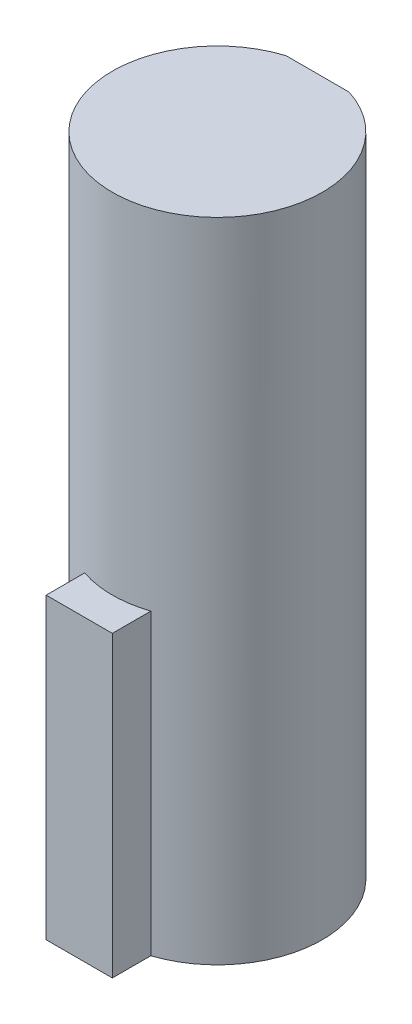
from build123d import *

# Parameters (mm, degrees)
BOSS_EXTRUDE1_DEPTH = 20.75
SKETCH2_R           = 7.3
BOSS_EXTRUDE2_DEPTH = 24.25
CUT_EXTRUDE1_DEPTH  = 50


with BuildPart() as part:
    # Sketch1 → Boss-Extrude1 (new body)
    with BuildSketch(Plane(origin=(0, 0, 0), x_dir=(1, 0, 0), z_dir=(0, 1, 0))):
        with BuildLine():
            Line((-2.3, -6.92820323), (-2.3, -9.601067812))
            Line((-2.3, -9.601067812), (2.3, -9.601067812))
            Line((2.3, -9.601067812), (2.3, -6.92820323))
            ThreePointArc((2.3, -6.92820323), (0, 7.3), (-2.3, -6.92820323))
        make_face()
    extrude(amount=BOSS_EXTRUDE1_DEPTH)

    # Sketch2 → Boss-Extrude2 (add)
    with BuildSketch(Plane(origin=(0, 20.75, 0), x_dir=(1, 0, 0), z_dir=(0, 1, 0))):
        with Locations(Location((0, 0, 0), (0, 0, 251.635051289))):
            Circle(SKETCH2_R)
    extrude(amount=BOSS_EXTRUDE2_DEPTH)

    # Sketch3 → Cut-Extrude1 (cut)
    with BuildSketch(Plane(origin=(0, 45, 0), x_dir=(1, 0, 0), z_dir=(0, 1, 0))):
        with BuildLine():
            Line((-2.5, 6.96491206), (2.5, 6.96491206))
            ThreePointArc((2.5, 6.96491206), (0, 7.4), (-2.5, 6.96491206))
        make_face()
    extrude(amount=-CUT_EXTRUDE1_DEPTH, mode=Mode.SUBTRACT)


solid = part.part
